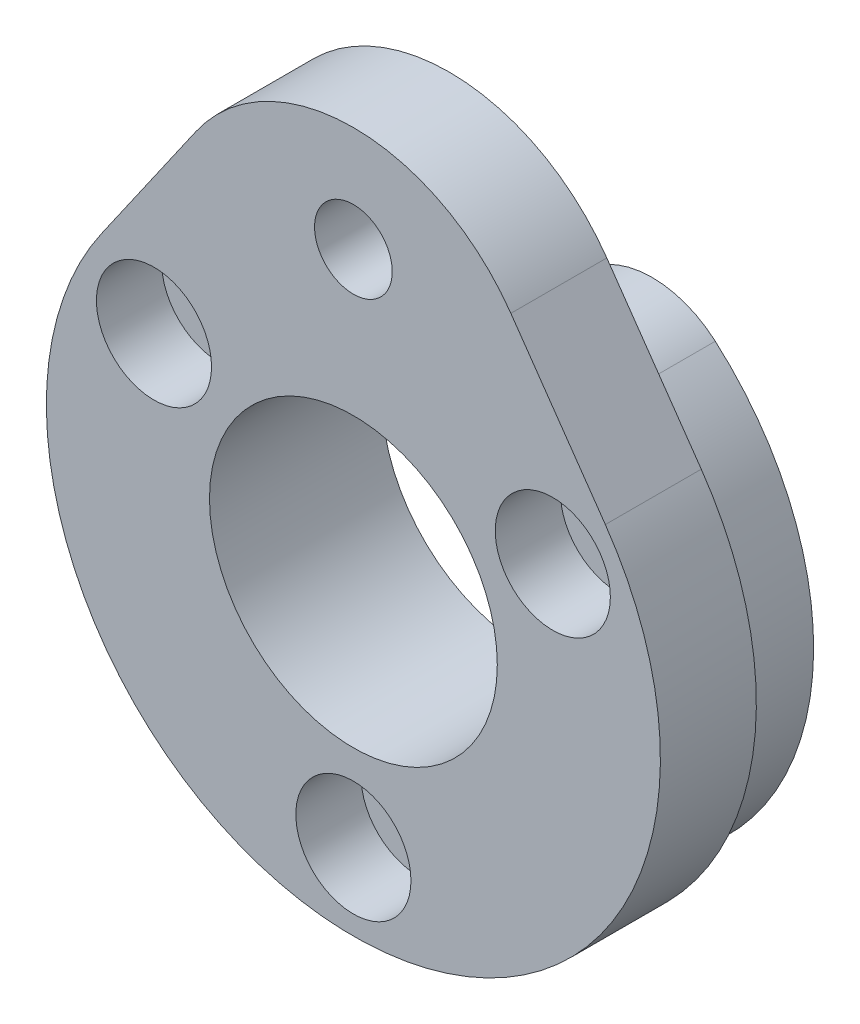
from build123d import *
from build123d.topology import SkipClean

# Parameters (mm, degrees)
SKETCH_1_R                   = 2.025
SKETCH_1_R_2                 = 7.5
EXTRUDE_1_DEPTH              = 5
FILLET_1_R                   = 10
EXTRUDE_START                = 4
SKETCH_6_R                   = 14.985
SKETCH_6_R_2                 = 7.5
EXTRUDE_2_DEPTH              = 4
HOLE_WIZARD_M3_2_D           = 3.2
HOLE_WIZARD_M3_2_CBORE_D     = 6
HOLE_WIZARD_M3_2_CBORE_DEPTH = 3.4
SKETCH_8_R                   = 5
CUT_EXTRUDE_1_DEPTH          = 4
SKETCH_4_R                   = 3.75
CUT_EXTRUDE_2_DEPTH          = 2.05
FILLET_2_R                   = 5
F_3_0MM_1_D                  = 3
F_3_0MM_1_DEPTH              = 4
F_3_0MM_1_TIP                = 0.901290929


with BuildPart() as part:
    # 草图1 → 凸台-拉伸1 (new body)
    with BuildSketch(Plane.XY):
        with BuildLine():
            Line((0, 28), (13.130428906, 9.142857143))
            ThreePointArc((13.130428906, 9.142857143), (0, -16), (-13.130428906, 9.142857143))
            Line((-13.130428906, 9.142857143), (0, 28))
        make_face()
        with Locations((0, 15)):
            Circle(SKETCH_1_R, mode=Mode.SUBTRACT)
        Circle(SKETCH_1_R_2, mode=Mode.SUBTRACT)
    extrude(amount=EXTRUDE_1_DEPTH)

    # 圆角1
    fillet_1_edges = [part.edges().sort_by_distance(p)[0] for p in [
        (0, 28, 2.5),
    ]]
    fillet(fillet_1_edges, radius=FILLET_1_R)

    # 草图6 → 凸台-拉伸2 (add)
    with SkipClean():  # the faces are left unmerged after this step: merging them gives an invalid solid
        with BuildSketch(Plane(origin=(0, 0, 0), x_dir=(-1, 0, 0), z_dir=(0, 0, -1)).offset(EXTRUDE_START)):
            with Locations(Location((0, 0, 0), (0, 0, 97.744482441))):
                Circle(SKETCH_6_R)
            Circle(SKETCH_6_R_2, mode=Mode.SUBTRACT)
        extrude(amount=-EXTRUDE_2_DEPTH)

    # M3 六角圆柱头螺钉的柱形沉头孔2 (through all)
    with Locations(Plane.XY.offset(5)):
        with Locations((10.392304845, 6), (0, -12), (-10.392304845, 6)):
            CounterBoreHole(HOLE_WIZARD_M3_2_D / 2, HOLE_WIZARD_M3_2_CBORE_D / 2, HOLE_WIZARD_M3_2_CBORE_DEPTH)

    # 草图8 → 切除-拉伸1 (cut)
    with SkipClean():  # the faces are left unmerged after this step: merging them gives an invalid solid
        with BuildSketch(Plane(origin=(0, 0, -4), x_dir=(-1, 0, 0), z_dir=(0, 0, -1))):
            with Locations((0.080926771, 14.984781475)):
                Circle(SKETCH_8_R)
        extrude(amount=-CUT_EXTRUDE_1_DEPTH, mode=Mode.SUBTRACT)

    # 草图4 → 切除-拉伸2 (cut)
    with SkipClean():  # the faces are left unmerged after this step: merging them gives an invalid solid
        with BuildSketch(Plane(origin=(0, 0, 0), x_dir=(-1, 0, 0), z_dir=(0, 0, -1))):
            with Locations((0, 15)):
                Circle(SKETCH_4_R)
        extrude(amount=-CUT_EXTRUDE_2_DEPTH, mode=Mode.SUBTRACT)

    # 圆角2
    fillet_2_edges = [part.edges().sort_by_distance(p)[0] for p in [
        (4.853431686, 14.177250293, -2),
        (-5.006275355, 14.124001985, -2),
    ]]
    fillet(fillet_2_edges, radius=FILLET_2_R)

    # Ø3.0mm 暗销孔1
    with Locations(Plane(origin=(0, 0, -4), x_dir=(-1, 0, 0), z_dir=(0, 0, -1))):
        with Locations((-10.392304845, -6), (10.392304845, -6)):
            Hole(F_3_0MM_1_D / 2, depth=F_3_0MM_1_DEPTH)
            with Locations((0, 0, -(F_3_0MM_1_DEPTH + F_3_0MM_1_TIP / 2))):  # 118° drill point
                Cone(0, F_3_0MM_1_D / 2, F_3_0MM_1_TIP, mode=Mode.SUBTRACT)


solid = part.part
